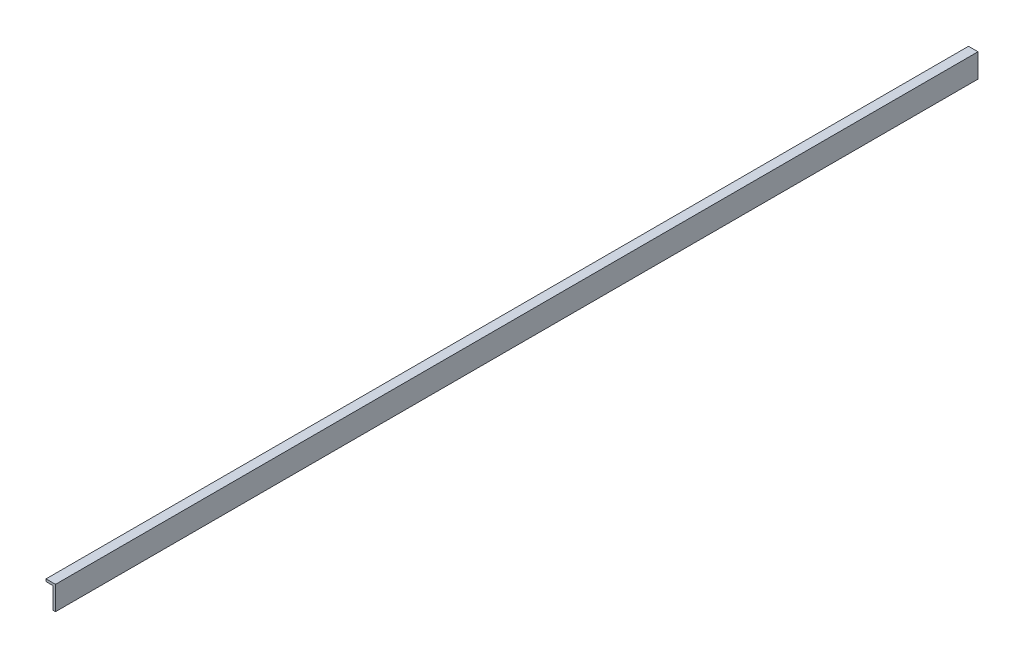
from build123d import *

# Parameters (mm, degrees)
LRAF_SAG_20X8X2_1_START = -20
LRAF_SAG_20X8X2_1_DEPTH = 777.5


with BuildPart() as part:
    # Sketch1 → LRAF_sag_20x8x2_1 (new body)
    with BuildSketch(Plane.XY.offset(LRAF_SAG_20X8X2_1_START)):
        Polygon((54, 0), (56, 0), (56, 20), (48, 20), (48, 18), (54, 18), align=None)
    extrude(amount=-LRAF_SAG_20X8X2_1_DEPTH)


solid = part.part
